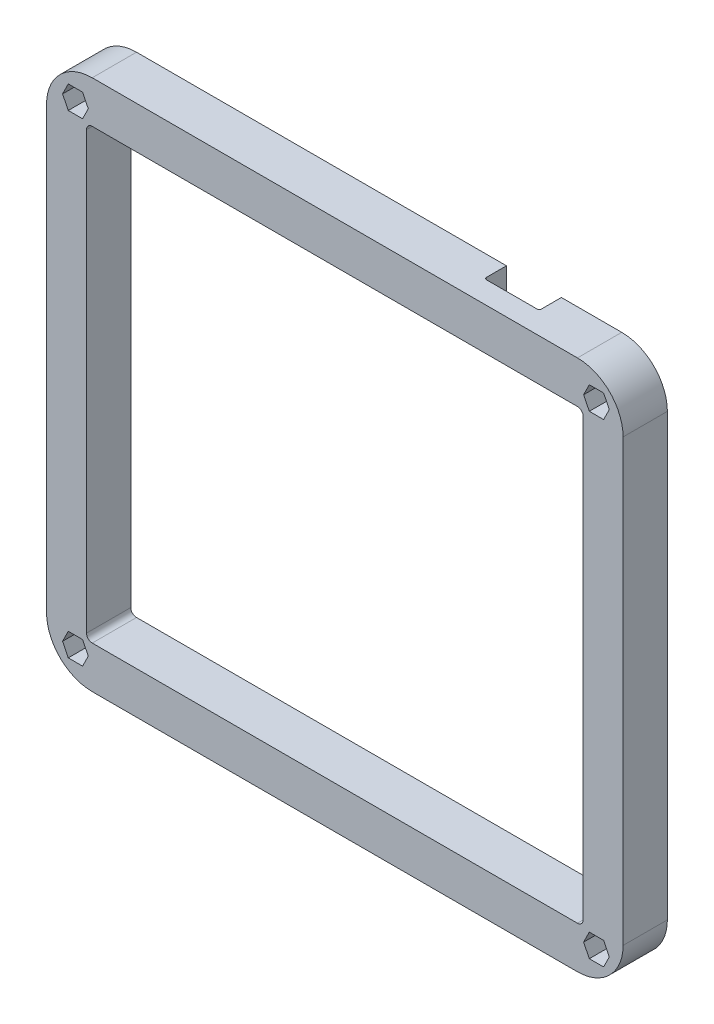
from build123d import *

# Parameters (mm, degrees)
AUFSATZ_LINEAR_AUSTRAGEN1_DEPTH = 10
SCHNITT_LINEAR_AUSTRAGEN1_REACH = 218.035
SKIZZE2_W                       = 12.4
SKIZZE2_H                       = 5
VERRUNDUNG1_R                   = 0.5


with BuildPart() as part:
    # Skizze1 → Aufsatz-Linear austragen1 (new body)
    with BuildSketch(Plane.XY):
        with BuildLine():
            Line((-59.5275, -41.5905), (-73.15, -41.5905))
            Line((-73.15, -41.5905), (-85.55, -41.5905))
            Line((-85.55, -41.5905), (-169.0581, -41.5905))
            ThreePointArc((-169.0581, -41.5905), (-176.514207067, -44.783915623), (-179.34742314, -52.3842))
            Line((-179.34742314, -52.3842), (-179.34742314, -150.803560266))
            ThreePointArc((-179.34742314, -150.803560266), (-176.514004305, -158.403485592), (-169.0581, -161.5967))
            Line((-169.0581, -161.5967), (-59.5275, -161.5967))
            ThreePointArc((-59.5275, -161.5967), (-52.244300154, -158.579899846), (-49.2275, -151.2967))
            Line((-49.2275, -151.2967), (-49.2275, -51.8905))
            ThreePointArc((-49.2275, -51.8905), (-52.244300154, -44.607300154), (-59.5275, -41.5905))
        make_face()
        Polygon((-174.462899882, -152.4967), (-171.231946398, -152.4967), (-169.94742314, -155.0967), (-171.231946398, -157.6967), (-174.462899882, -157.6967), (-175.74742314, -155.0967), align=None, mode=Mode.SUBTRACT)
        Polygon((-58.1338, -155.0967), (-56.849276742, -152.4967), (-53.618323258, -152.4967), (-52.3338, -155.0967), (-53.618323258, -157.6967), (-56.849276742, -157.6967), align=None, mode=Mode.SUBTRACT)
        Polygon((-175.74742314, -48.0905), (-174.462899882, -45.4905), (-171.231946398, -45.4905), (-169.94742314, -48.0905), (-171.231946398, -50.6905), (-174.462899882, -50.6905), align=None, mode=Mode.SUBTRACT)
        with BuildLine():
            Line((-85.55, -51.0905), (-73.15, -51.0905))
            Line((-73.15, -51.0905), (-59.5275, -51.0905))
            ThreePointArc((-59.5275, -51.0905), (-58.612715957, -51.469415957), (-58.2338, -52.3842))
            Line((-58.2338, -52.3842), (-58.2338, -150.803))
            ThreePointArc((-58.2338, -150.803), (-58.612715957, -151.717784043), (-59.5275, -152.0967))
            Line((-59.5275, -152.0967), (-169.0581, -152.0967))
            ThreePointArc((-169.0581, -152.0967), (-169.972884043, -151.717784043), (-170.3518, -150.803))
            Line((-170.3518, -150.803), (-170.3518, -52.3842))
            ThreePointArc((-170.3518, -52.3842), (-169.972884043, -51.469415957), (-169.0581, -51.0905))
            Line((-169.0581, -51.0905), (-85.55, -51.0905))
        make_face(mode=Mode.SUBTRACT)
        Polygon((-58.1338, -48.0905), (-56.849276742, -45.4905), (-53.618323258, -45.4905), (-52.3338, -48.0905), (-53.618323258, -50.6905), (-56.849276742, -50.6905), align=None, mode=Mode.SUBTRACT)
    extrude(amount=AUFSATZ_LINEAR_AUSTRAGEN1_DEPTH)

    # Skizze2 → Schnitt-Linear austragen1 (cut, up to next)
    with BuildSketch(Plane(origin=(0, -41.5905, 0), x_dir=(1, 0, 0), z_dir=(0, 1, 0)), mode=Mode.PRIVATE) as schnitt_linear_austragen1_sk1:
        with Locations((-79.35, -2.5)):
            Rectangle(SKIZZE2_W, SKIZZE2_H)
    schnitt_linear_austragen1_tool1 = extrude(schnitt_linear_austragen1_sk1.sketch, amount=-SCHNITT_LINEAR_AUSTRAGEN1_REACH, mode=Mode.PRIVATE) & part.part
    add(schnitt_linear_austragen1_tool1.solids().sort_by_distance((-79.35, -41.5905, 2.5))[0], mode=Mode.SUBTRACT)

    # Verrundung1
    verrundung1_edges = [part.edges().sort_by_distance(p)[0] for p in [
        (-85.55, -46.3405, 5),
        (-73.15, -46.3405, 5),
    ]]
    fillet(verrundung1_edges, radius=VERRUNDUNG1_R)


solid = part.part
